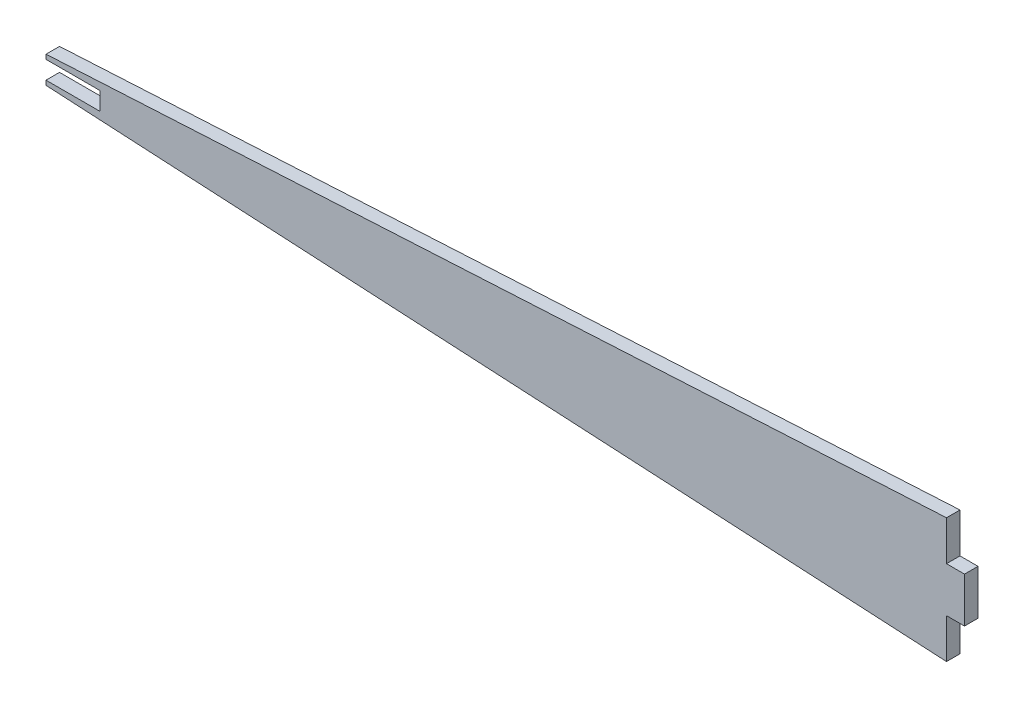
from build123d import *

# Parameters (mm, degrees)
EXTRUDE_1_DEPTH = 1.5


with BuildPart() as part:
    # Model → 凸台-拉伸1 (new body)
    with BuildSketch(Plane.XY):
        Polygon((100.818561425, 0.588779312), (100.818561425, 5.010377872), (102.818561425, 5.010377872), (102.818561425, 10.010377872), (100.818561425, 10.010377872), (100.818561425, 14.431978731), (0.759361425, 9.010377872), (0.759361425, 8.510377872), (6.759361425, 8.510377872), (6.759361425, 7.510377872), (6.759361425, 6.510377872), (0.759361425, 6.510377872), (0.759361425, 6.010377872), align=None)
    extrude(amount=EXTRUDE_1_DEPTH)


solid = part.part
